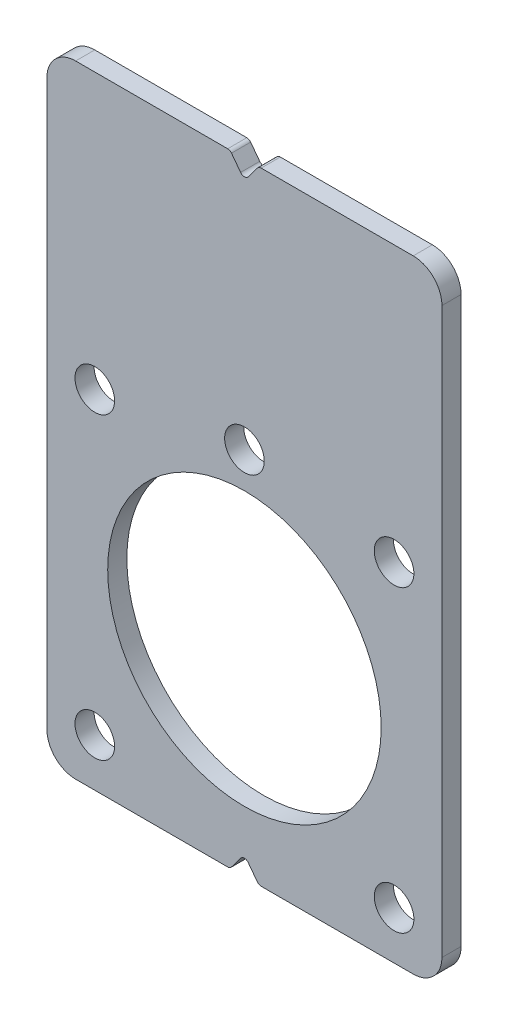
from build123d import *

# Parameters (mm, degrees)
SKETCH2_R               = 20.6375
SKETCH2_R_2             = 14.2875
BOSS_EXTRUDE1_DEPTH     = 1
CUT_EXTRUDE1_DEPTH      = 49.96874322
CUT_EXTRUDE1_DEPTH_BACK = 49.96874322
SKETCH3_R               = 2.07
FILLET1_R               = 3
FILLET3_R               = 0.5


with BuildPart() as part:
    # Sketch2 → Boss-Extrude1 (new, symmetric)
    # profile 1 of 4: a face of its own
    with BuildSketch(Plane.XY):
        Circle(SKETCH2_R)
        Circle(SKETCH2_R_2, mode=Mode.SUBTRACT)
    # profile 2 of 4: a face of its own
    with BuildSketch(Plane.XY):
        with BuildLine():
            Line((-20.6375, 44.3625), (-20.6375, 0))
            ThreePointArc((-20.6375, 0), (0, 20.6375), (20.6375, 0))
            Line((20.6375, 0), (20.6375, 44.3625))
            Line((20.6375, 44.3625), (-20.6375, 44.3625))
        make_face()
    # profile 3 of 4: a face of its own
    with BuildSketch(Plane.XY):
        with BuildLine():
            ThreePointArc((20.6375, 0), (14.592916166, -14.592916227), (-8.6e-08, -20.6375))
            Line((-8.6e-08, -20.6375), (20.6375, -20.6375))
            Line((20.6375, -20.6375), (20.6375, 0))
        make_face()
    # profile 4 of 4: a face of its own
    with BuildSketch(Plane.XY):
        with BuildLine():
            Line((-20.6375, 0), (-20.6375, -20.6375))
            Line((-20.6375, -20.6375), (-8.6e-08, -20.6375))
            ThreePointArc((-8.6e-08, -20.6375), (-14.592916227, -14.592916166), (-20.6375, 0))
        make_face()
    extrude(amount=BOSS_EXTRUDE1_DEPTH, both=True)

    # Sketch3 → Cut-Extrude1 (cut, two sides: drawn at the far end of the back side and taken through both)
    with BuildSketch(Plane.XY.offset(1).offset(-CUT_EXTRUDE1_DEPTH_BACK)):
        with Locations((0, 18)):
            Circle(SKETCH3_R)
        with Locations((-15.6375, -15.6375)):
            Circle(SKETCH3_R)
        with Locations((15.6375, -15.6375)):
            Circle(SKETCH3_R)
        with Locations((15.6375, 15.6375)):
            Circle(SKETCH3_R)
        with Locations((-15.6375, 15.6375)):
            Circle(SKETCH3_R)
        Polygon((0, 44.3625), (-1.5, 44.3625), (0, 42.3625), (1.5, 44.3625), align=None)
        Polygon((1.5, -20.6375), (0, -18.6375), (-1.5, -20.6375), (0, -20.6375), align=None)
    extrude(amount=CUT_EXTRUDE1_DEPTH + CUT_EXTRUDE1_DEPTH_BACK, mode=Mode.SUBTRACT)

    # Fillet1
    fillet1_edges = [part.edges().sort_by_distance(p)[0] for p in [
        (-20.6375, -20.6375, 0),
        (-20.6375, 44.3625, 0),
        (20.6375, 44.3625, 0),
        (20.6375, -20.6375, 0),
    ]]
    fillet(fillet1_edges, radius=FILLET1_R)

    # Fillet3
    fillet3_edges = [part.edges().sort_by_distance(p)[0] for p in [
        (1.5, -20.6375, 0),
        (-1.5, -20.6375, 0),
        (0, -18.6375, 0),
        (1.5, 44.3625, 0),
        (0, 42.3625, 0),
        (-1.5, 44.3625, 0),
    ]]
    fillet(fillet3_edges, radius=FILLET3_R)


solid = part.part
